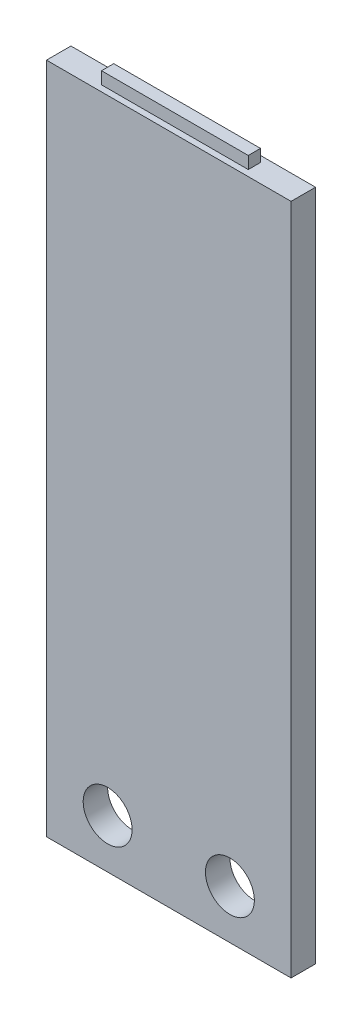
from build123d import *

# Parameters (mm, degrees)
SKETCH1_W           = 100
SKETCH1_H           = 275
BOSS_EXTRUDE1_DEPTH = 10
SKETCH2_W           = 60
SKETCH2_H           = 5
BOSS_EXTRUDE2_DEPTH = 5
SKETCH3_R           = 10
CUT_EXTRUDE1_DEPTH  = 152.348108677


with BuildPart() as part:
    # Sketch1 → Boss-Extrude1 (new body)
    with BuildSketch(Plane.XY):
        Rectangle(SKETCH1_W, SKETCH1_H)
    extrude(amount=BOSS_EXTRUDE1_DEPTH)

    # Sketch2 → Boss-Extrude2 (add)
    with BuildSketch(Plane(origin=(0, 137.5, 0), x_dir=(1, 0, 0), z_dir=(0, 1, 0))):
        with Locations((0, -5)):
            Rectangle(SKETCH2_W, SKETCH2_H)
    extrude(amount=BOSS_EXTRUDE2_DEPTH)

    # Sketch3 → Cut-Extrude1 (cut, through all)
    with BuildSketch(Plane.XY.offset(10)):
        with Locations((25, -117.5)):
            Circle(SKETCH3_R)
        with Locations(Location((-25, -117.5, 0), (0, 0, 180))):
            Circle(SKETCH3_R)
    extrude(amount=-CUT_EXTRUDE1_DEPTH, mode=Mode.SUBTRACT)


solid = part.part
